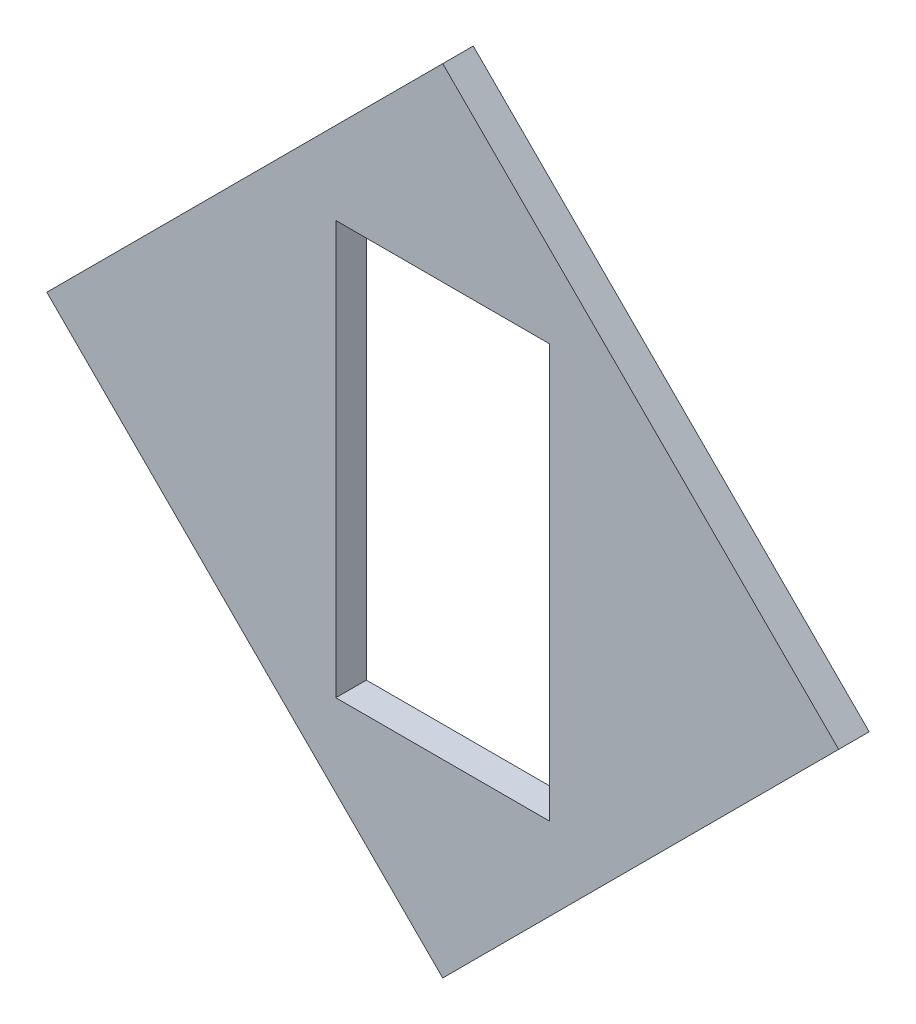
from build123d import *

# Parameters (mm, degrees)
BOSS_EXTRUDE1_DEPTH = 3
SKETCH2_W           = 21
SKETCH2_H           = 40.6
CUT_EXTRUDE1_DEPTH  = 3


with BuildPart() as part:
    # Sketch1 → Boss-Extrude1 (new body)
    with BuildSketch(Plane.XY):
        Polygon((-38.890872965, 0), (0, 38.890872965), (38.890872965, 0), (0, -38.890872965), align=None)
    extrude(amount=BOSS_EXTRUDE1_DEPTH)

    # Sketch2 → Cut-Extrude1 (cut)
    with BuildSketch(Plane.XY.offset(3)):
        Rectangle(SKETCH2_W, SKETCH2_H)
    extrude(amount=-CUT_EXTRUDE1_DEPTH, mode=Mode.SUBTRACT)


solid = part.part
